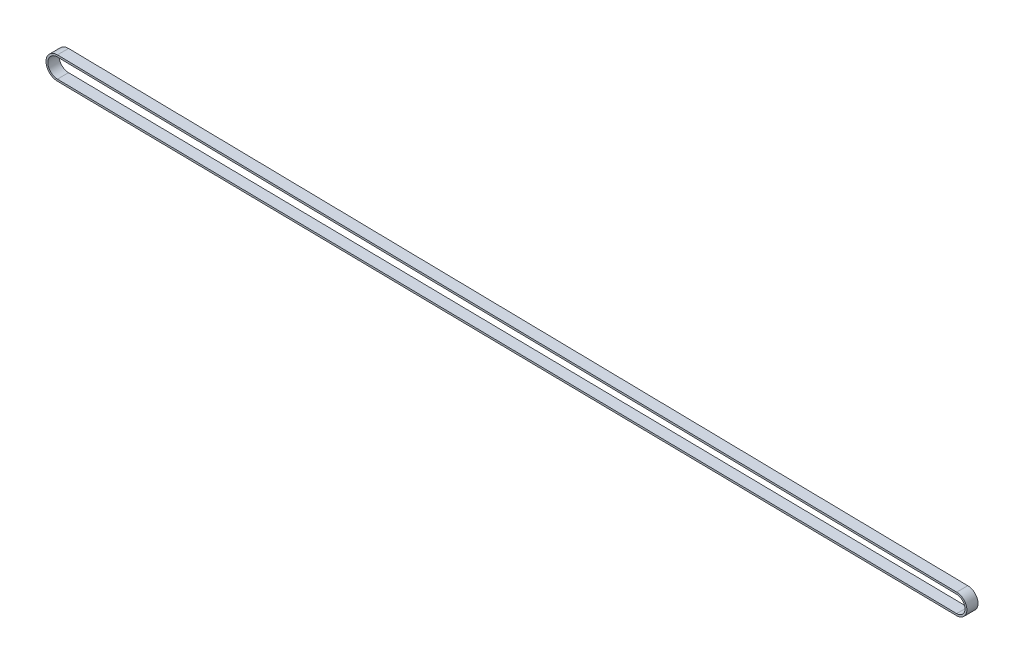
from build123d import *

# Parameters (mm, degrees)
BOSS_EXTRUDE1_DEPTH = 6


with BuildPart() as part:
    # Sketch1 → Boss-Extrude1 (new body)
    with BuildSketch(Plane.XY):
        with BuildLine():
            ThreePointArc((483.92628469, -13.296951286), (489.42628469, -7.796951286), (483.92628469, -2.296951286))
            Line((483.92628469, -2.296951286), (0.214631564, 6.146253598))
            Line((0.214631564, 6.146253598), (0, 6.15))
            ThreePointArc((0, 6.15), (-6.15, 0), (0, -6.15))
            Line((0, -6.15), (483.763864662, -13.294552557))
            Line((483.763864662, -13.294552557), (483.92628469, -13.296951286))
        make_face()
        with BuildLine():
            ThreePointArc((0, -5.15), (-5.15, 0), (0, 5.15))
            ThreePointArc((0, 5.15), (0.08987975, 5.149215633), (0.179732122, 5.146862769))
            Line((0.179732122, 5.146862769), (483.92628469, -3.296951286))
            ThreePointArc((483.92628469, -3.296951286), (488.42628469, -7.796951286), (483.92628469, -12.296951286))
            Line((483.92628469, -12.296951286), (0, -5.15))
        make_face(mode=Mode.SUBTRACT)
    extrude(amount=BOSS_EXTRUDE1_DEPTH)


solid = part.part
